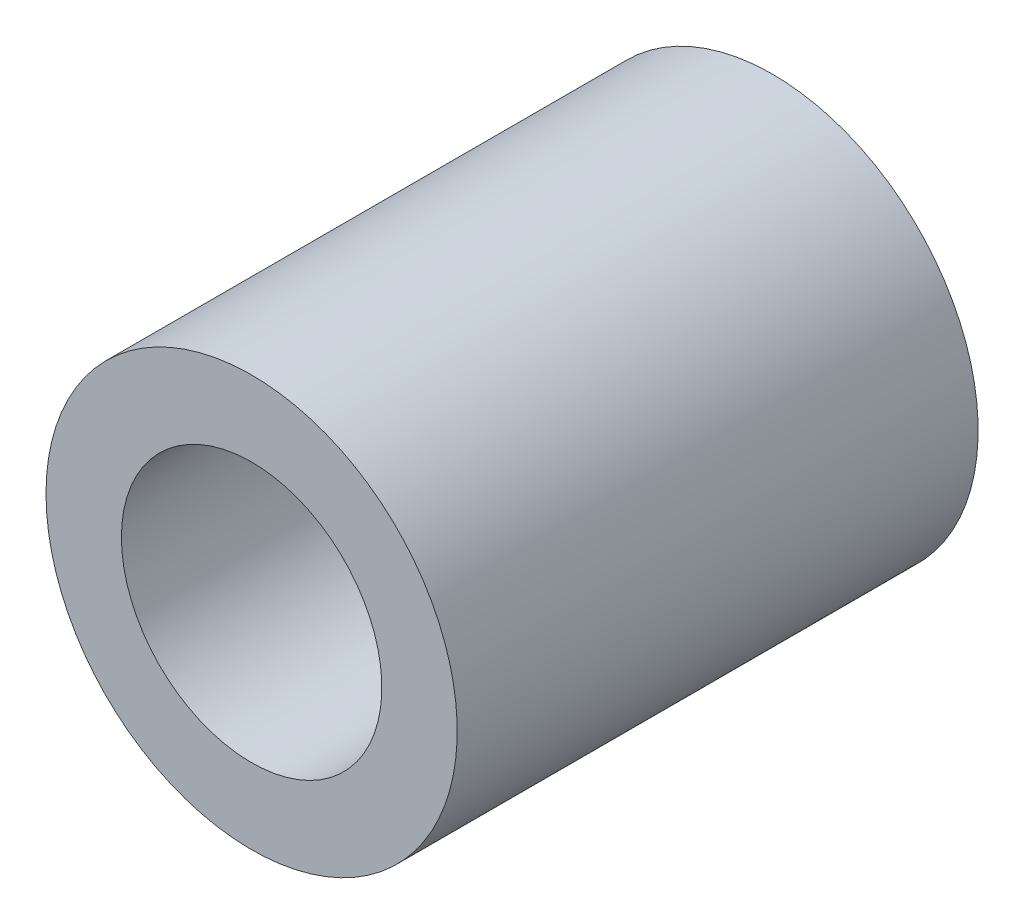
from build123d import *

# Parameters (mm, degrees)
CROQUIS1_R              = 3
CROQUIS1_R_2            = 1.9
SALIENTE_EXTRUIR1_DEPTH = 7.6


with BuildPart() as part:
    # Croquis1 → Saliente-Extruir1 (new body)
    with BuildSketch(Plane.XY):
        with Locations(Location((0, 0, 0), (0, 0, 180))):
            Circle(CROQUIS1_R)
        with Locations(Location((0, 0, 0), (0, 0, 180))):
            Circle(CROQUIS1_R_2, mode=Mode.SUBTRACT)
    extrude(amount=SALIENTE_EXTRUIR1_DEPTH)


solid = part.part
